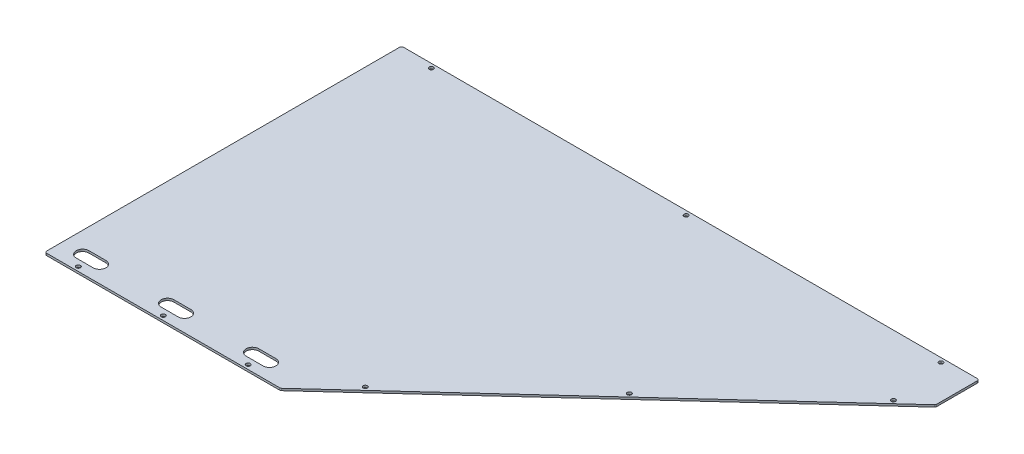
from build123d import *

# Parameters (mm, degrees)
BOSS_EXTRUDE1_DEPTH         = 3.175
FILLET1_R                   = 3.175
F_1_4_0_25_DIAMETER_HOLE1_D = 6.35
SKETCH5_R                   = 3.175
CUT_EXTRUDE1_DEPTH          = 1016.052018679


with BuildPart() as part:
    # Sketch1 → Boss-Extrude1 (new body)
    with BuildSketch(Plane(origin=(0, 0, 0), x_dir=(1, 0, 0), z_dir=(0, 1, 0))):
        Polygon((0, 0), (352.425, 0), (863.6, 468.405587878), (863.6, 533.4), (0, 533.4), align=None)
    extrude(amount=BOSS_EXTRUDE1_DEPTH)

    # Fillet1
    fillet1_edges = [part.edges().sort_by_distance(p)[0] for p in [
        (0, 1.5875, -533.4),
        (863.6, 1.5875, -533.4),
        (863.6, 1.5875, -468.405587878),
        (352.425, 1.5875, 0),
        (0, 1.5875, 0),
    ]]
    fillet(fillet1_edges, radius=FILLET1_R)

    # 1/4 (0.25) Diameter Hole1 (through all)
    with Locations(Plane(origin=(0, 3.175, 0), x_dir=(1, 0, 0), z_dir=(0, 1, 0))):
        with Locations((43.832655013, 6.35), (170.832655013, 6.35), (297.832655013, 6.35), (414.05335701, 65.084754558), (620.048644915, 253.844658566), (826.043932819, 442.604562573), (50.8, 527.05), (431.8, 527.05), (812.8, 527.05)):
            Hole(F_1_4_0_25_DIAMETER_HOLE1_D / 2)

    # Sketch5 → Cut-Extrude1 (cut, through all)
    with BuildSketch(Plane(origin=(0, 3.175, 0), x_dir=(1, 0, 0), z_dir=(0, 1, 0))):
        with Locations(Location((297.832655013, 6.35, 0), (0, 0, 270))):
            Circle(SKETCH5_R)
        with Locations(Location((170.832655013, 6.35, 0), (0, 0, 270))):
            Circle(SKETCH5_R)
        with Locations(Location((43.832655013, 6.35, 0), (0, 0, 270))):
            Circle(SKETCH5_R)
        with BuildLine():
            Line((31.132655013, 34.925), (56.532655013, 34.925))
            ThreePointArc((56.532655013, 34.925), (66.057655013, 25.4), (56.532655013, 15.875))
            Line((56.532655013, 15.875), (31.132655013, 15.875))
            ThreePointArc((31.132655013, 15.875), (21.607655013, 25.4), (31.132655013, 34.925))
        make_face()
        with BuildLine():
            Line((158.132655013, 34.925), (183.532655013, 34.925))
            ThreePointArc((183.532655013, 34.925), (193.057655013, 25.4), (183.532655013, 15.875))
            Line((183.532655013, 15.875), (158.132655013, 15.875))
            ThreePointArc((158.132655013, 15.875), (148.607655013, 25.4), (158.132655013, 34.925))
        make_face()
        with BuildLine():
            Line((285.132655013, 34.925), (310.532655013, 34.925))
            ThreePointArc((310.532655013, 34.925), (320.057655013, 25.4), (310.532655013, 15.875))
            Line((310.532655013, 15.875), (285.132655013, 15.875))
            ThreePointArc((285.132655013, 15.875), (275.607655013, 25.4), (285.132655013, 34.925))
        make_face()
    extrude(amount=-CUT_EXTRUDE1_DEPTH, mode=Mode.SUBTRACT)


solid = part.part
